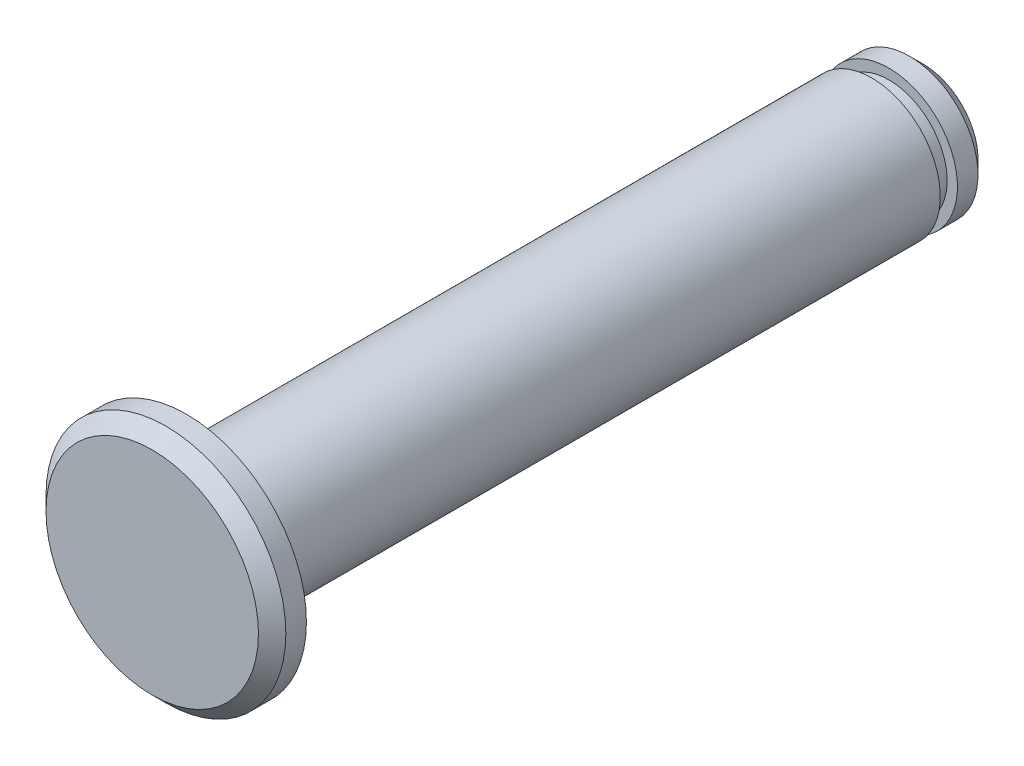
from build123d import *

# Parameters (mm, degrees)
CHAMFER1_SIZE = 0.8


with BuildPart() as part:
    # Sketch1 → Revolve1 (revolve)
    with BuildSketch(Plane(origin=(0, 0, 0), x_dir=(1, 0, 0), z_dir=(0, 1, 0))):
        Polygon((0, -9.103389831), (-7, -9.103389831), (-7, -7.103389831), (-4, -7.103389831), (-4, 32.896610169), (-3.4, 32.896610169), (-3.4, 33.896610169), (-4, 33.896610169), (-4, 35.896610169), (0, 35.896610169), align=None)
    revolve(axis=Axis((0, 0, -59.924518123), (0, 0, 1)))

    # Chamfer1
    chamfer1_edges = [part.edges().sort_by_distance(p)[0] for p in [
        (4, 0, -35.896610169),
        (7, 0, 9.103389831),
    ]]
    chamfer(chamfer1_edges, length=CHAMFER1_SIZE)


solid = part.part
